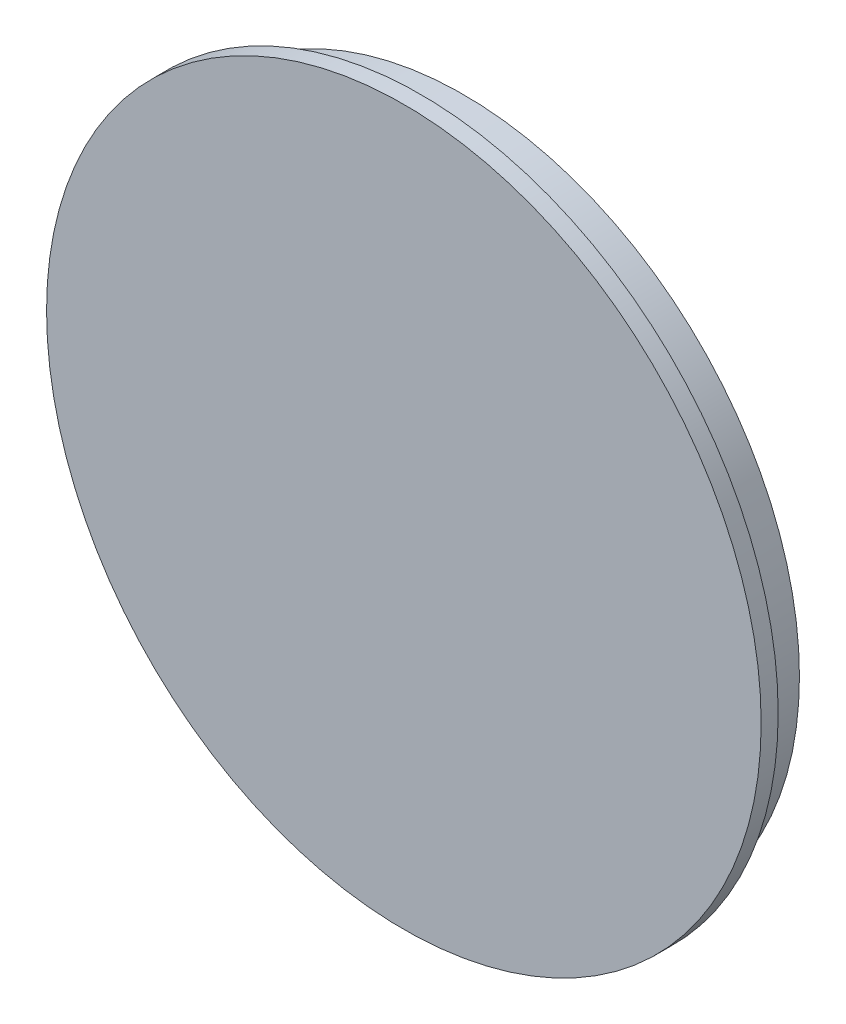
from build123d import *

# Parameters (mm, degrees)
SKETCH1_R           = 39.5
SKETCH1_R_2         = 37.5
BOSS_EXTRUDE1_DEPTH = 5
SKETCH2_R           = 42
BOSS_EXTRUDE2_DEPTH = 2
FILLET1_R           = 2


with BuildPart() as part:
    # Sketch1 → Boss-Extrude1 (new body)
    with BuildSketch(Plane.XY):
        Circle(SKETCH1_R)
        Circle(SKETCH1_R_2, mode=Mode.SUBTRACT)
    extrude(amount=BOSS_EXTRUDE1_DEPTH)

    # Sketch2 → Boss-Extrude2 (add)
    with BuildSketch(Plane.XY.offset(5)):
        Circle(SKETCH2_R)
    extrude(amount=BOSS_EXTRUDE2_DEPTH)

    # Fillet1
    fillet1_edges = [part.edges().sort_by_distance(p)[0] for p in [
        (-37.5, 0, 5),
    ]]
    fillet(fillet1_edges, radius=FILLET1_R)


solid = part.part
